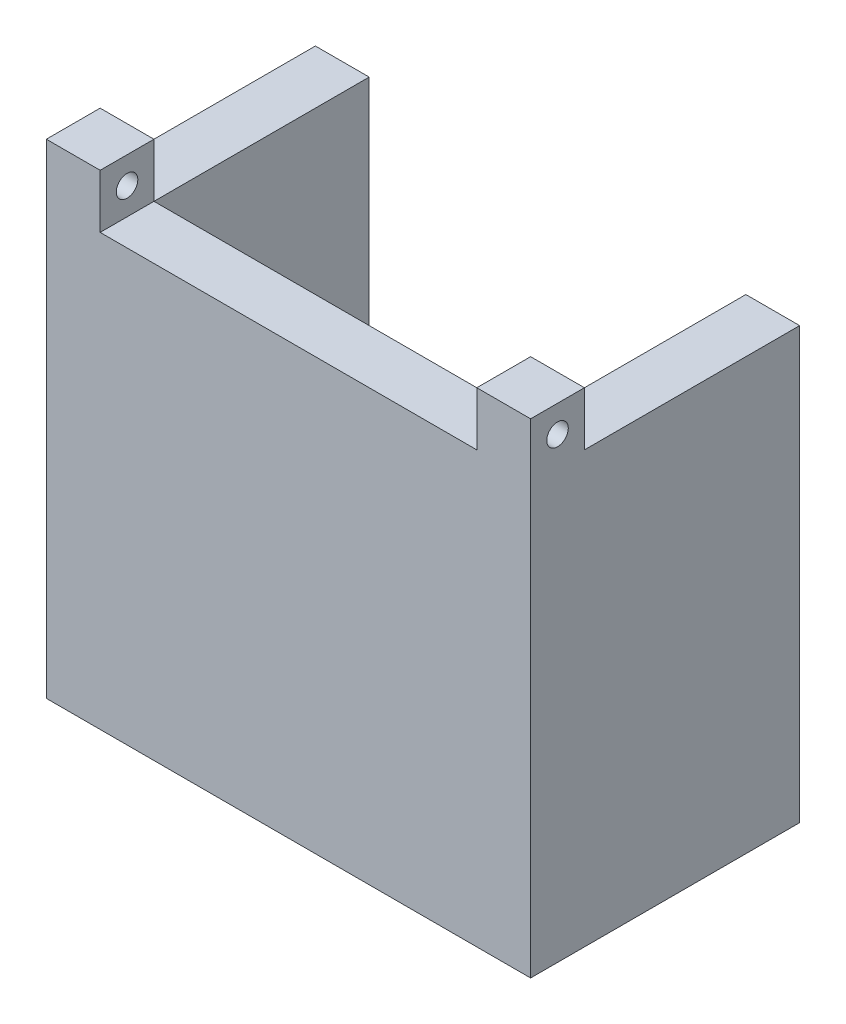
from build123d import *

# Parameters (mm, degrees)
SKETCH_1_W          = 45
SKETCH_1_H          = 45
EXTRUDE_1_DEPTH     = 5
SKETCH_2_R          = 1
CUT_EXTRUDE_2_DEPTH = 5
SKETCH_3_W          = 35
SKETCH_3_H          = 5
CUT_EXTRUDE_3_DEPTH = 33.210246817
SKETCH_4_W          = 5
SKETCH_4_H          = 40
EXTRUDE_2_DEPTH     = 20


with BuildPart() as part:
    # 草圖1 → 填料-伸長1 (new body)
    with BuildSketch(Plane.XY):
        Rectangle(SKETCH_1_W, SKETCH_1_H)
    extrude(amount=EXTRUDE_1_DEPTH)

    # 草圖2 → 除料-伸長2 (cut)
    with BuildSketch(Plane(origin=(22.5, 0, 0), x_dir=(0, 0, -1), z_dir=(1, 0, 0))):
        with Locations(Location((-2.5, 20, 0), (0, 0, 90))):
            Circle(SKETCH_2_R)
    cut_extrude_2 = extrude(amount=-CUT_EXTRUDE_2_DEPTH, mode=Mode.SUBTRACT)

    # 草圖3 → 除料-伸長3 (cut, through all)
    with BuildSketch(Plane(origin=(0, 0, 0), x_dir=(-1, 0, 0), z_dir=(0, 0, -1))):
        with Locations((0, 20)):
            Rectangle(SKETCH_3_W, SKETCH_3_H)
    extrude(amount=-CUT_EXTRUDE_3_DEPTH, mode=Mode.SUBTRACT)

    # 鏡射1: 除料-伸長2 across plane
    add(cut_extrude_2.mirror(Plane(origin=(0, 0, 0), x_dir=(0, 0, 1), z_dir=(1, 0, 0))), mode=Mode.SUBTRACT)

    # 草圖4 → 填料-伸長2 (add)
    with BuildSketch(Plane(origin=(0, 0, 0), x_dir=(-1, 0, 0), z_dir=(0, 0, -1))):
        with Locations((-20, -2.5)):
            Rectangle(SKETCH_4_W, SKETCH_4_H)
    extrude_2 = extrude(amount=EXTRUDE_2_DEPTH)

    # 鏡射2: 填料-伸長2 across plane
    add(extrude_2.mirror(Plane(origin=(0, 0, 0), x_dir=(0, 0, 1), z_dir=(1, 0, 0))))


solid = part.part
